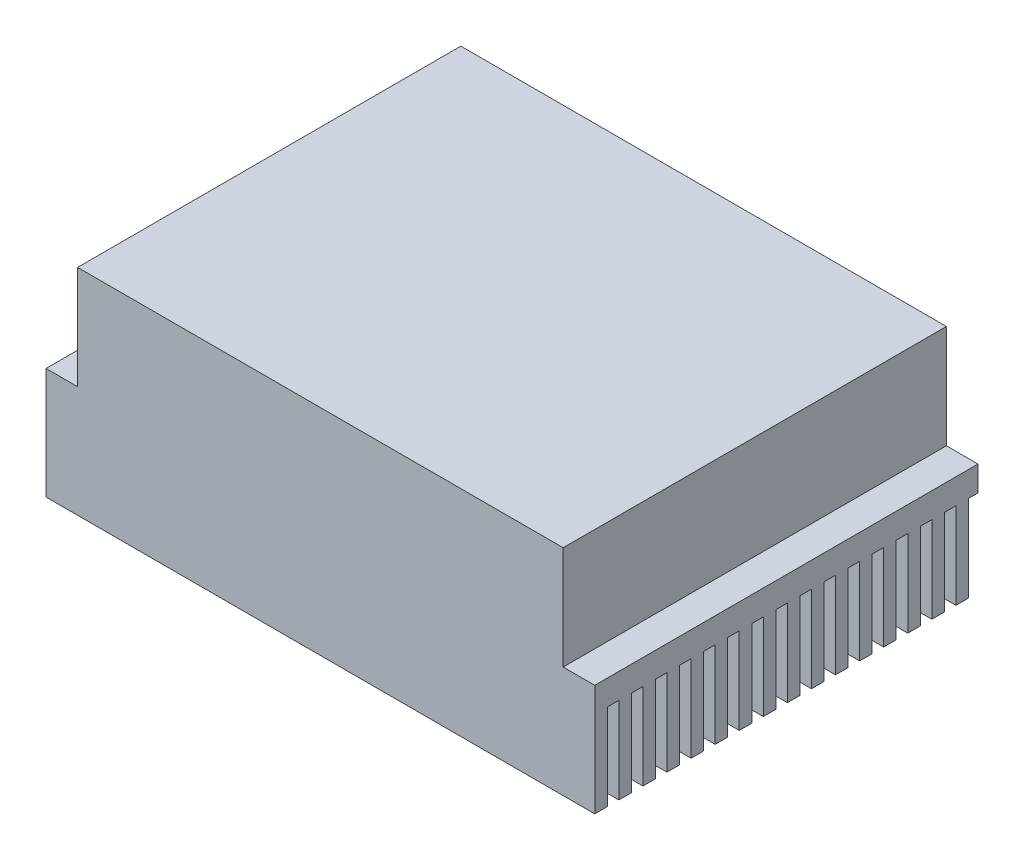
from build123d import *

# Parameters (mm, degrees)
SKETCH1_W           = 122.936
SKETCH1_H           = 97.028
BOSS_EXTRUDE1_DEPTH = 26.162
SKETCH2_W           = 138.938
SKETCH2_H           = 97.028
BOSS_EXTRUDE2_DEPTH = 6.35
SKETCH3_W           = 3.175
SKETCH3_H           = 21.844
BOSS_EXTRUDE3_DEPTH = 138.938


with BuildPart() as part:
    # Sketch1 → Boss-Extrude1 (new body)
    with BuildSketch(Plane(origin=(0, 0, 0), x_dir=(1, 0, 0), z_dir=(0, 1, 0))):
        Rectangle(SKETCH1_W, SKETCH1_H)
    extrude(amount=BOSS_EXTRUDE1_DEPTH)

    # Sketch2 → Boss-Extrude2 (add)
    with BuildSketch(Plane.XZ):
        Rectangle(SKETCH2_W, SKETCH2_H)
    extrude(amount=BOSS_EXTRUDE2_DEPTH)

    # Sketch3 → Boss-Extrude3 (add, through all)
    with BuildSketch(Plane(origin=(69.469, 0, 0), x_dir=(0, 0, -1), z_dir=(1, 0, 0))):
        with Locations((-40.8305, -17.272)):
            Rectangle(SKETCH3_W, SKETCH3_H)
        with Locations((-46.9265, -17.272)):
            Rectangle(SKETCH3_W, SKETCH3_H)
        with Locations((-34.7345, -17.272)):
            Rectangle(SKETCH3_W, SKETCH3_H)
        with Locations((-28.6385, -17.272)):
            Rectangle(SKETCH3_W, SKETCH3_H)
        with Locations((-22.5425, -17.272)):
            Rectangle(SKETCH3_W, SKETCH3_H)
        with Locations((-16.4465, -17.272)):
            Rectangle(SKETCH3_W, SKETCH3_H)
        with Locations((-10.3505, -17.272)):
            Rectangle(SKETCH3_W, SKETCH3_H)
        with Locations((-4.2545, -17.272)):
            Rectangle(SKETCH3_W, SKETCH3_H)
        with Locations((1.8415, -17.272)):
            Rectangle(SKETCH3_W, SKETCH3_H)
        with Locations((7.9375, -17.272)):
            Rectangle(SKETCH3_W, SKETCH3_H)
        with Locations((14.0335, -17.272)):
            Rectangle(SKETCH3_W, SKETCH3_H)
        with Locations((20.1295, -17.272)):
            Rectangle(SKETCH3_W, SKETCH3_H)
        with Locations((26.2255, -17.272)):
            Rectangle(SKETCH3_W, SKETCH3_H)
        with Locations((32.3215, -17.272)):
            Rectangle(SKETCH3_W, SKETCH3_H)
        with Locations((38.4175, -17.272)):
            Rectangle(SKETCH3_W, SKETCH3_H)
        with Locations((44.5135, -17.272)):
            Rectangle(SKETCH3_W, SKETCH3_H)
    extrude(amount=-BOSS_EXTRUDE3_DEPTH)


solid = part.part
